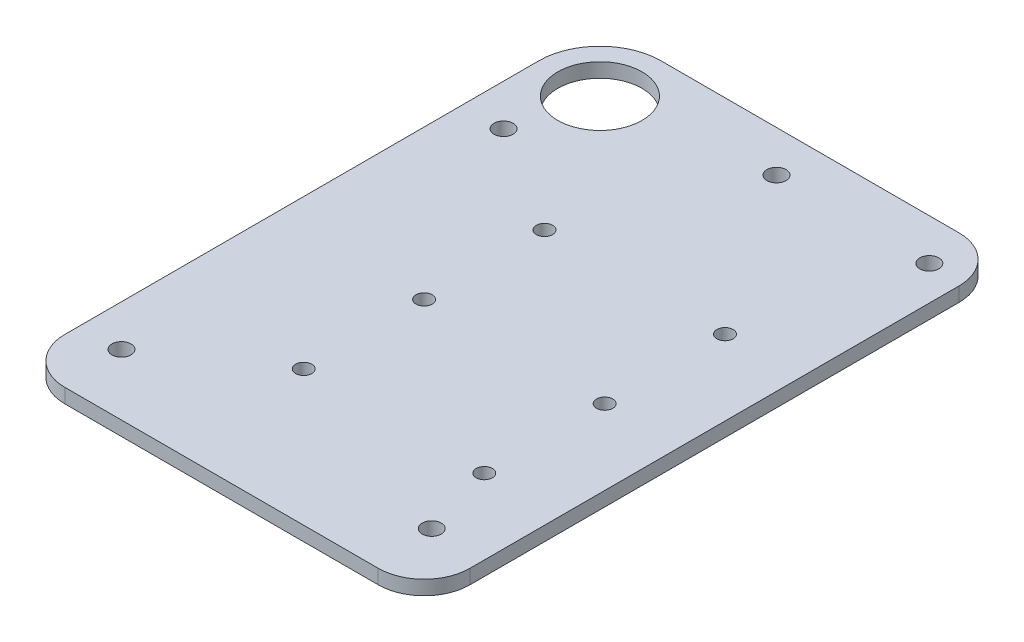
from build123d import *

# Parameters (mm, degrees)
SKETCH1_R           = 3.175
SKETCH1_R_2         = 2.7
SKETCH1_R_3         = 14
BOSS_EXTRUDE1_DEPTH = 4.7625
FILLET1_R           = 15.24


with BuildPart() as part:
    # Sketch1 → Boss-Extrude1 (new body)
    with BuildSketch(Plane(origin=(0, 0, 0), x_dir=(1, 0, 0), z_dir=(0, 1, 0))):
        with BuildLine():
            Line((114.3, 20.32), (0, 20.32))
            ThreePointArc((0, 20.32), (-14.368409794, 14.368409794), (-20.32, 0))
            Line((-20.32, 0), (-20.32, -172.72))
            Line((-20.32, -172.72), (114.3, -172.72))
            Line((114.3, -172.72), (114.3, 20.32))
        make_face()
        with Locations(Location((-6.604, -152.4, 0), (0, 0, 90))):
            Circle(SKETCH1_R, mode=Mode.SUBTRACT)
        with Locations(Location((29.297861909, -127.72, 0), (0, 0, 90))):
            Circle(SKETCH1_R_2, mode=Mode.SUBTRACT)
        with Locations(Location((29.297861909, -87.72, 0), (0, 0, 90))):
            Circle(SKETCH1_R_2, mode=Mode.SUBTRACT)
        with Locations(Location((96.52, -152.4, 0), (0, 0, 90))):
            Circle(SKETCH1_R, mode=Mode.SUBTRACT)
        with Locations(Location((89.297861909, -127.72, 0), (0, 0, 90))):
            Circle(SKETCH1_R_2, mode=Mode.SUBTRACT)
        with Locations(Location((89.297861909, -87.72, 0), (0, 0, 90))):
            Circle(SKETCH1_R_2, mode=Mode.SUBTRACT)
        with Locations(Location((29.297861909, -47.72, 0), (0, 0, 90))):
            Circle(SKETCH1_R_2, mode=Mode.SUBTRACT)
        with Locations(Location((-6.604, -25.4, 0), (0, 0, 90))):
            Circle(SKETCH1_R, mode=Mode.SUBTRACT)
        with Locations(Location((89.297861909, -47.72, 0), (0, 0, 90))):
            Circle(SKETCH1_R_2, mode=Mode.SUBTRACT)
        with Locations(Location((52.07, 6.604, 0), (0, 0, 90))):
            Circle(SKETCH1_R, mode=Mode.SUBTRACT)
        with Locations(Location((102.87, 6.604, 0), (0, 0, 90))):
            Circle(SKETCH1_R, mode=Mode.SUBTRACT)
        with Locations(Location((0, 0, 0), (0, 0, 90))):
            Circle(SKETCH1_R_3, mode=Mode.SUBTRACT)
    extrude(amount=BOSS_EXTRUDE1_DEPTH)

    # Fillet1
    fillet1_edges = [part.edges().sort_by_distance(p)[0] for p in [
        (114.3, 2.38125, -20.32),
        (114.3, 2.38125, 172.72),
        (-20.32, 2.38125, 172.72),
    ]]
    fillet(fillet1_edges, radius=FILLET1_R)


solid = part.part
